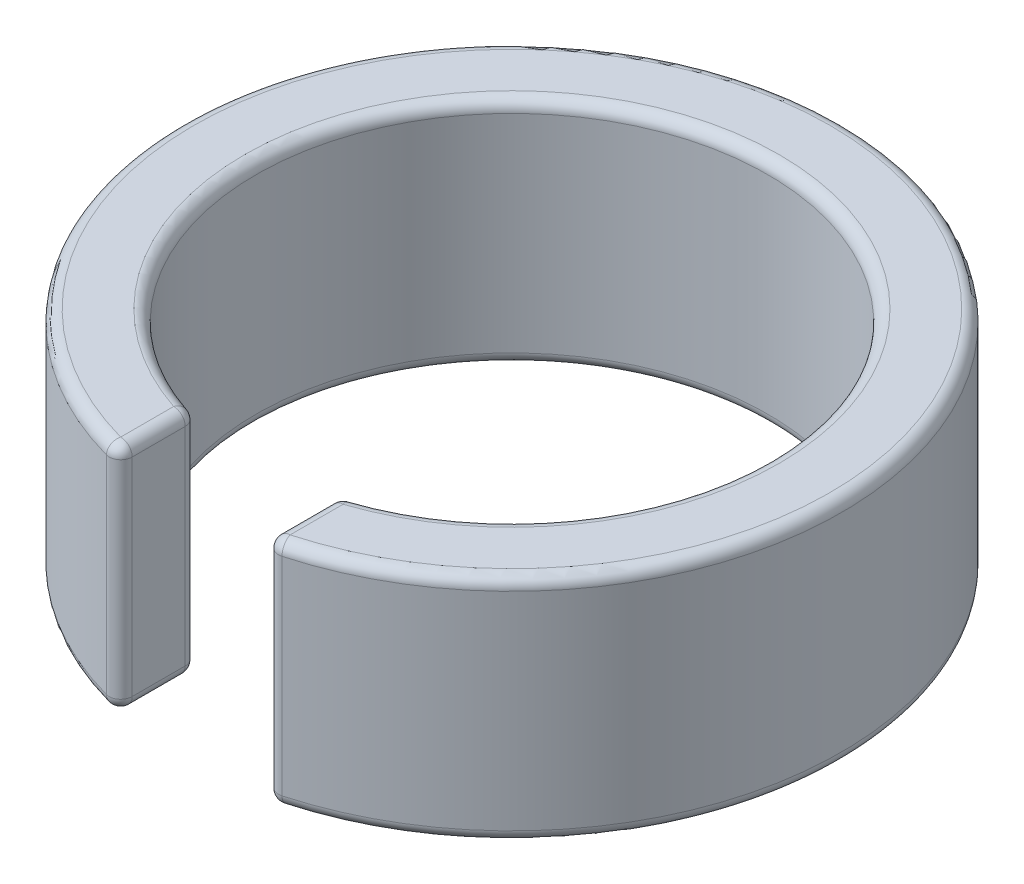
from build123d import *

# Parameters (mm, degrees)
SKETCH1_R           = 14.3
SKETCH1_R_2         = 11.1
BOSS_EXTRUDE1_DEPTH = 10
SKETCH2_W           = 6.35
SKETCH2_H           = 14.3
CUT_EXTRUDE1_DEPTH  = 23.560585099
FILLET1_R           = 0.5


with BuildPart() as part:
    # Sketch1 → Boss-Extrude1 (new body)
    with BuildSketch(Plane(origin=(0, 0, 0), x_dir=(1, 0, 0), z_dir=(0, 1, 0))):
        Circle(SKETCH1_R)
        Circle(SKETCH1_R_2, mode=Mode.SUBTRACT)
    extrude(amount=BOSS_EXTRUDE1_DEPTH)

    # Sketch2 → Cut-Extrude1 (cut, through all)
    with BuildSketch(Plane(origin=(0, 0, 0), x_dir=(1, 0, 0), z_dir=(0, 1, 0))):
        with Locations((0, -7.15)):
            Rectangle(SKETCH2_W, SKETCH2_H)
    extrude(amount=CUT_EXTRUDE1_DEPTH, mode=Mode.SUBTRACT)

    # Fillet1
    fillet1_edges = [part.edges().sort_by_distance(p)[0] for p in [
        (0, 0, -11.1),
        (3.175, 0, 12.289652799),
        (0, 0, -14.3),
        (-3.175, 0, 12.289652799),
        (3.175, 10, 12.289652799),
        (0, 10, -11.1),
        (-3.175, 10, 12.289652799),
        (0, 10, -14.3),
        (3.175, 5, 10.63622936),
        (3.175, 5, 13.943076239),
        (-3.175, 5, 10.63622936),
        (-3.175, 5, 13.943076239),
    ]]
    fillet(fillet1_edges, radius=FILLET1_R)


solid = part.part
